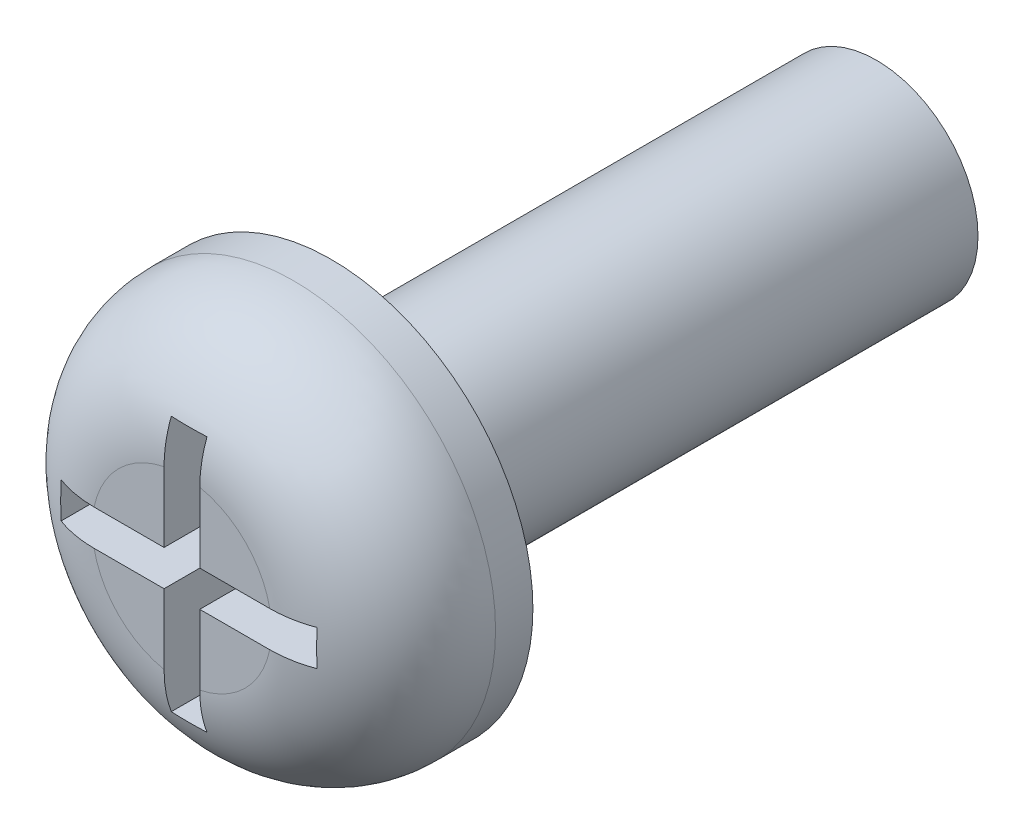
from build123d import *

# Parameters (mm, degrees)
SKETCH1_R           = 1.7272
BOSS_EXTRUDE1_DEPTH = 9.271
SKETCH2_R           = 3.429
BOSS_EXTRUDE2_DEPTH = 2.54
FILLET1_R           = 1.905
CUT_EXTRUDE1_DEPTH  = 1.905


with BuildPart() as part:
    # Sketch1 → Boss-Extrude1 (new body)
    with BuildSketch(Plane.XY):
        Circle(SKETCH1_R)
    extrude(amount=BOSS_EXTRUDE1_DEPTH)

    # Sketch2 → Boss-Extrude2 (add)
    with BuildSketch(Plane.XY.offset(9.271)):
        Circle(SKETCH2_R)
    extrude(amount=BOSS_EXTRUDE2_DEPTH)

    # Fillet1
    fillet1_edges = [part.edges().sort_by_distance(p)[0] for p in [
        (-3.429, 0, 11.811),
    ]]
    fillet(fillet1_edges, radius=FILLET1_R)

    # Sketch3 → Cut-Extrude1 (cut)
    with BuildSketch(Plane.XY.offset(11.811)):
        Polygon((-0.303567799, 0.303567799), (-0.303567799, 2.17637078), (0.303567799, 2.17637078), (0.303567799, 0.303567799), (2.17637078, 0.303567799), (2.17637078, -0.303567799), (0.303567799, -0.303567799), (0.303567799, -2.17637078), (-0.303567799, -2.17637078), (-0.303567799, -0.303567799), (-2.17637078, -0.303567799), (-2.17637078, 0.303567799), align=None)
    extrude(amount=-CUT_EXTRUDE1_DEPTH, mode=Mode.SUBTRACT)


solid = part.part
